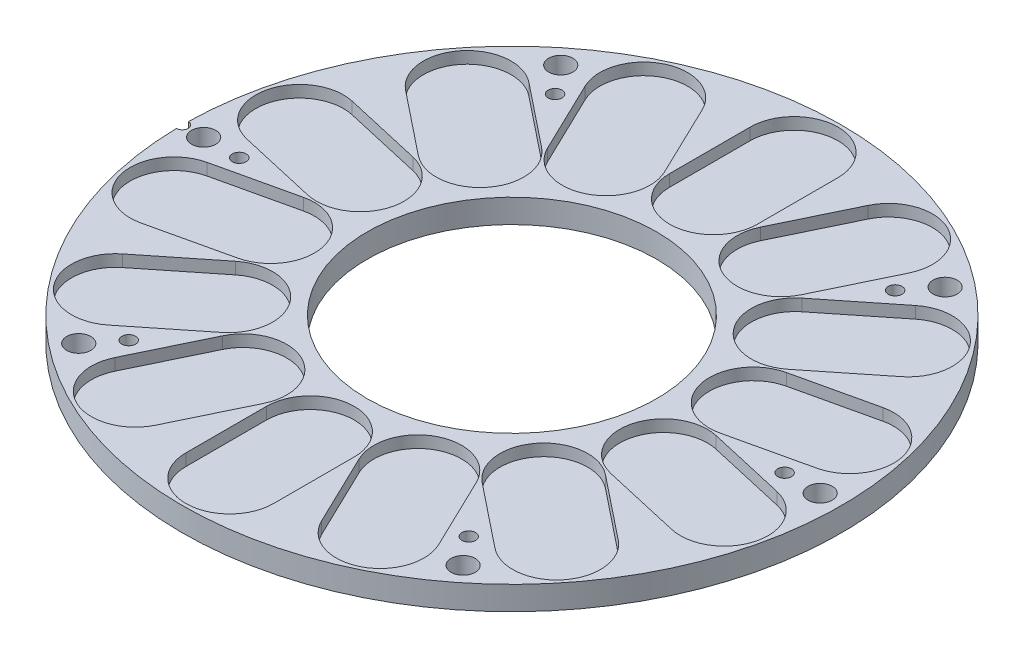
from build123d import *

# Parameters (mm, degrees)
SKETCH_1_R               = 139
SKETCH_1_R_2             = 61
EXTRUDE_1_DEPTH          = 10
CUT_EXTRUDE_1_DEPTH      = 5
PATTERN_CIRCULAR_2_COUNT = 14
SKETCH_3_R               = 5.1
CUT_EXTRUDE_2_DEPTH      = 197.829875781
SKETCH_8_R               = 5.1
CUT_EXTRUDE_3_DEPTH      = 197.829875781
SKETCH_10_R              = 2.5
CUT_EXTRUDE_4_DEPTH      = 197.829875781
MIRROR_2_COPY_1_SKETCH_R = 5.1
MIRROR_2_COPY_1_DEPTH    = 197.829875781
M5_BASE_PLATE_D          = 5.8


with BuildPart() as part:
    # ｽｹｯﾁ1 → ﾎﾞｽ - 押し出し1 (new body)
    with BuildSketch(Plane(origin=(0, 0, 0), x_dir=(1, 0, 0), z_dir=(0, 1, 0))):
        with Locations(Location((0, 0, 0), (0, 0, 270))):
            Circle(SKETCH_1_R)
        with Locations(Location((0, 0, 0), (0, 0, 270))):
            Circle(SKETCH_1_R_2, mode=Mode.SUBTRACT)
    extrude(amount=EXTRUDE_1_DEPTH)

    # ｽｹｯﾁ2 → ｶｯﾄ - 押し出し1 (cut)
    with BuildSketch(Plane(origin=(0, 10, 0), x_dir=(1, 0, 0), z_dir=(0, 1, 0))):
        with BuildLine():
            Line((18.5, 119), (18.5, 85))
            ThreePointArc((18.5, 85), (0, 66.5), (-18.5, 85))
            Line((-18.5, 85), (-18.5, 119))
            ThreePointArc((-18.5, 119), (0, 137.5), (18.5, 119))
        make_face()
    cut_extrude_1 = extrude(amount=-CUT_EXTRUDE_1_DEPTH, mode=Mode.SUBTRACT)

    # 円形ﾊﾟﾀｰﾝ2: ｶｯﾄ - 押し出し1 ×14 about axis
    pattern_circular_2_axis = Axis((0, 0, 0), (0, 1, 0))
    for i in range(1, PATTERN_CIRCULAR_2_COUNT):
        add(cut_extrude_1.rotate(pattern_circular_2_axis, i * 360 / PATTERN_CIRCULAR_2_COUNT), mode=Mode.SUBTRACT)

    # ｽｹｯﾁ3 → ｶｯﾄ - 押し出し2 (cut, through all)
    with BuildSketch(Plane(origin=(0, 10, 0), x_dir=(1, 0, 0), z_dir=(0, 1, 0))):
        with Locations(Location((130, 0, 0), (0, 0, 270))):
            Circle(SKETCH_3_R)
    cut_extrude_2 = extrude(amount=-CUT_EXTRUDE_2_DEPTH, mode=Mode.SUBTRACT)

    # ｽｹｯﾁ8 → ｶｯﾄ - 押し出し3 (cut, through all)
    with BuildSketch(Plane(origin=(0, 10, 0), x_dir=(1, 0, 0), z_dir=(0, 1, 0))):
        with Locations(Location((81.053674242, 101.638092721, 0), (0, 0, 270))):
            Circle(SKETCH_8_R)
    cut_extrude_3 = extrude(amount=-CUT_EXTRUDE_3_DEPTH, mode=Mode.SUBTRACT)

    # ｽｹｯﾁ10 → ｶｯﾄ - 押し出し4 (cut, through all)
    with BuildSketch(Plane(origin=(0, 10, 0), x_dir=(1, 0, 0), z_dir=(0, 1, 0))):
        with Locations((-139, 0)):
            Circle(SKETCH_10_R)
    extrude(amount=-CUT_EXTRUDE_4_DEPTH, mode=Mode.SUBTRACT)

    # ﾐﾗｰ1: ｶｯﾄ - 押し出し3 across plane
    add(cut_extrude_3.mirror(Plane.XY), mode=Mode.SUBTRACT)

    # ﾐﾗｰ2: ｶｯﾄ - 押し出し2, ｶｯﾄ - 押し出し3 across plane
    add(cut_extrude_2.mirror(Plane(origin=(0, 0, 0), x_dir=(0, 0, 1), z_dir=(1, 0, 0))), mode=Mode.SUBTRACT)
    add(cut_extrude_3.mirror(Plane(origin=(0, 0, 0), x_dir=(0, 0, 1), z_dir=(1, 0, 0))), mode=Mode.SUBTRACT)

    # ﾐﾗｰ2 copy 1 sketch → ﾐﾗｰ2 copy 1 (cut, through all)
    with BuildSketch(Plane(origin=(0, 10, 0), x_dir=(-1, 0, 0), z_dir=(0, 1, 0))):
        with Locations(Location((81.053674242, 101.638092721, 0), (0, 0, 270))):
            Circle(MIRROR_2_COPY_1_SKETCH_R)
    extrude(amount=-MIRROR_2_COPY_1_DEPTH, mode=Mode.SUBTRACT)

    # M5 Base_Plateへの固定用穴 (through all)
    with Locations(Plane(origin=(71.701327214, 10, -89.910620484), x_dir=(0, 0, 1), z_dir=(0, 1, 0))):
        with Locations((0, 0), (89.910620484, 43.298672786), (179.821240968, 0), (179.821240968, -143.402654428), (89.910620484, -186.701327214), (0, -143.402654428)):
            Hole(M5_BASE_PLATE_D / 2)


solid = part.part
